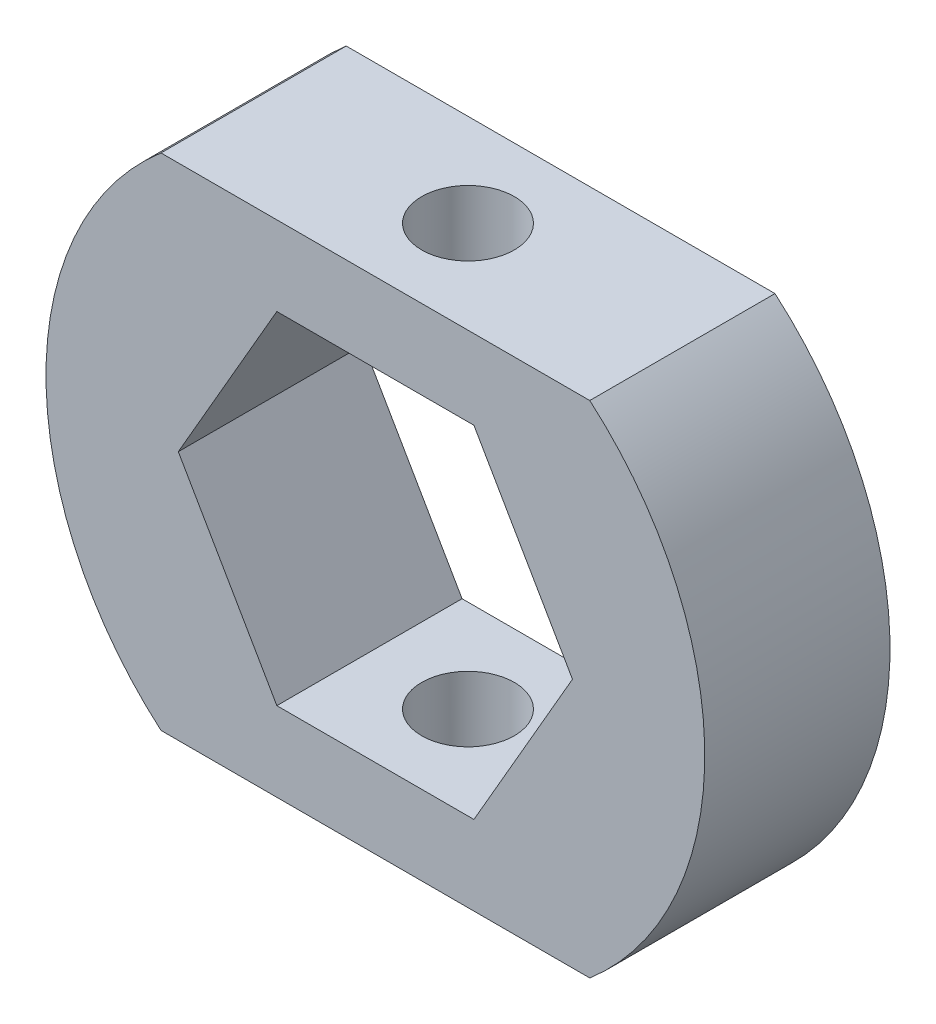
from build123d import *

# Parameters (mm, degrees)
BOSS_EXTRUDE1_DEPTH = 3.5
SKETCH2_R           = 1.75
CUT_EXTRUDE1_DEPTH  = 23.899960365


with BuildPart() as part:
    # Sketch1 → Boss-Extrude1 (new, symmetric)
    with BuildSketch(Plane.XY):
        with BuildLine():
            Line((-8.102202461, 9.45), (8.102202461, 9.45))
            ThreePointArc((8.102202461, 9.45), (12.447818473, 0), (8.102202461, -9.45))
            Line((8.102202461, -9.45), (-8.102202461, -9.45))
            ThreePointArc((-8.102202461, -9.45), (-12.447818473, 0), (-8.102202461, 9.45))
        make_face()
        Polygon((7.447818473, 0), (3.723909236, 6.45), (-3.723909236, 6.45), (-7.447818473, 0), (-3.723909236, -6.45), (3.723909236, -6.45), align=None, mode=Mode.SUBTRACT)
    extrude(amount=BOSS_EXTRUDE1_DEPTH, both=True)

    # Sketch2 → Cut-Extrude1 (cut, through all)
    with BuildSketch(Plane(origin=(0, 9.45, 0), x_dir=(1, 0, 0), z_dir=(0, 1, 0))):
        with Locations(Location((0, 0, 0), (0, 0, 270))):
            Circle(SKETCH2_R)
    extrude(amount=-CUT_EXTRUDE1_DEPTH, mode=Mode.SUBTRACT)


solid = part.part
